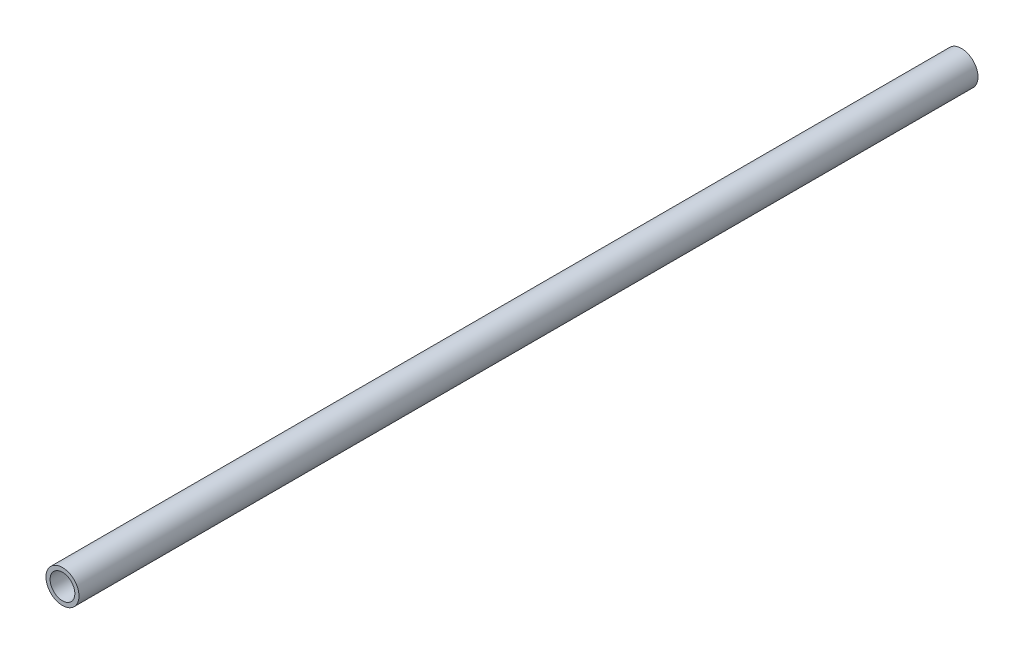
from build123d import *

# Parameters (mm, degrees)
ESQUISSE1_R        = 4
ESQUISSE1_R_2      = 3
EXTRU_MINCE1_DEPTH = 218


with BuildPart() as part:
    # Esquisse1 → Extru.-Mince1 (new body)
    with BuildSketch(Plane.XY):
        Circle(ESQUISSE1_R)
        Circle(ESQUISSE1_R_2, mode=Mode.SUBTRACT)
    extrude(amount=EXTRU_MINCE1_DEPTH)


solid = part.part
